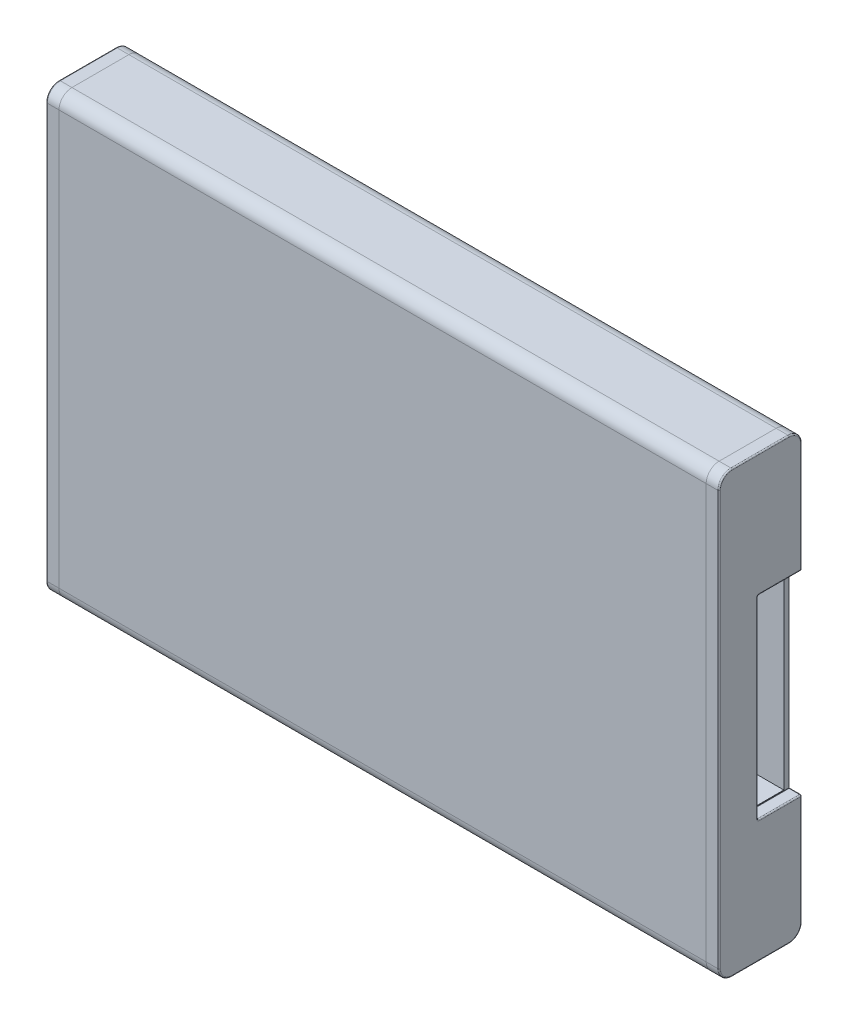
from build123d import *

# Parameters (mm, degrees)
SKETCH1_W           = 255
SKETCH1_H           = 170
BOSS_EXTRUDE1_DEPTH = 32
FILLET1_R           = 5
CUT_EXTRUDE1_DEPTH  = 5
BOSS_EXTRUDE2_DEPTH = 5
SKETCH4_W           = 17
SKETCH4_H           = 75
CUT_EXTRUDE2_DEPTH  = 5
SKETCH5_W           = 15
SKETCH5_H           = 75
CUT_EXTRUDE3_DEPTH  = 100
FILLET2_R           = 0.5
BOSS_EXTRUDE3_DEPTH = 5
FILLET3_R           = 0.5


with BuildPart() as part:
    # Sketch1 → Boss-Extrude1 (new body)
    with BuildSketch(Plane.XY):
        with Locations((127.5, 85)):
            Rectangle(SKETCH1_W, SKETCH1_H)
    extrude(amount=BOSS_EXTRUDE1_DEPTH)

    # Fillet1
    fillet1_edges = [part.edges().sort_by_distance(p)[0] for p in [
        (127.5, 170, 32),
        (127.5, 170, 0),
        (127.5, 0, 0),
        (127.5, 0, 32),
    ]]
    fillet(fillet1_edges, radius=FILLET1_R)

    # Sketch2 → Cut-Extrude1 (cut)
    with BuildSketch(Plane(origin=(255, 0, 0), x_dir=(0, 0, -1), z_dir=(1, 0, 0))):
        with BuildLine():
            Line((-32, 165), (-32, 5))
            ThreePointArc((-32, 5), (-30.535533906, 1.464466094), (-27, 0))
            Line((-27, 0), (-5, 0))
            ThreePointArc((-5, 0), (-1.464466094, 1.464466094), (0, 5))
            Line((0, 5), (0, 165))
            ThreePointArc((0, 165), (-1.464466094, 168.535533906), (-5, 170))
            Line((-5, 170), (-27, 170))
            ThreePointArc((-27, 170), (-30.535533906, 168.535533906), (-32, 165))
        make_face()
    extrude(amount=-CUT_EXTRUDE1_DEPTH, mode=Mode.SUBTRACT)

    # Sketch5 → Cut-Extrude3 (cut)
    with BuildSketch(Plane(origin=(250, 0, 0), x_dir=(0, 0, -1), z_dir=(1, 0, 0))):
        with Locations((-9.5, 85)):
            Rectangle(SKETCH5_W, SKETCH5_H)
    extrude(amount=-CUT_EXTRUDE3_DEPTH, mode=Mode.SUBTRACT)


with BuildPart() as body_2:
    # Sketch3 → Boss-Extrude2 (new body)
    with BuildSketch(Plane(origin=(250, 0, 0), x_dir=(0, 0, -1), z_dir=(1, 0, 0))):
        with BuildLine():
            Line((-32, 165), (-32, 5))
            ThreePointArc((-32, 5), (-30.535533906, 1.464466094), (-27, 0))
            Line((-27, 0), (-5, 0))
            ThreePointArc((-5, 0), (-1.464466094, 1.464466094), (0, 5))
            Line((0, 5), (0, 165))
            ThreePointArc((0, 165), (-1.464466094, 168.535533906), (-5, 170))
            Line((-5, 170), (-27, 170))
            ThreePointArc((-27, 170), (-30.535533906, 168.535533906), (-32, 165))
        make_face()
    extrude(amount=BOSS_EXTRUDE2_DEPTH)

    # Sketch4 → Cut-Extrude2 (cut)
    with BuildSketch(Plane(origin=(255, 0, 0), x_dir=(0, 0, -1), z_dir=(1, 0, 0))):
        with Locations((-8.5, 85)):
            Rectangle(SKETCH4_W, SKETCH4_H)
    extrude(amount=-CUT_EXTRUDE2_DEPTH, mode=Mode.SUBTRACT)

    # Fillet2
    fillet2_edges = [body_2.edges().sort_by_distance(p)[0] for p in [
        (255, 1.464466094, 30.535533906),
        (255, 0, 16),
        (255, 1.464466094, 1.464466094),
        (255, 26.25, 0),
        (255, 143.75, 0),
        (255, 168.535533906, 1.464466094),
        (252.5, 122.5, 0),
        (250, 47.5, 8.5),
        (252.5, 47.5, 0),
        (250, 85, 17),
        (252.5, 47.5, 17),
        (250, 122.5, 8.5),
        (252.5, 122.5, 17),
        (255, 122.5, 8.5),
        (255, 170, 16),
        (255, 85, 17),
        (255, 47.5, 8.5),
        (255, 168.535533906, 30.535533906),
        (255, 85, 32),
    ]]
    fillet(fillet2_edges, radius=FILLET2_R)


with BuildPart() as body_3:
    # Sketch6 → Boss-Extrude3 (new body)
    with BuildSketch(Plane.ZY):
        with BuildLine():
            Line((5, 0), (27, 0))
            ThreePointArc((27, 0), (30.535533906, 1.464466094), (32, 5))
            Line((32, 5), (32, 165))
            ThreePointArc((32, 165), (30.535533906, 168.535533906), (27, 170))
            Line((27, 170), (5, 170))
            ThreePointArc((5, 170), (1.464466094, 168.535533906), (0, 165))
            Line((0, 165), (0, 5))
            ThreePointArc((0, 5), (1.464466094, 1.464466094), (5, 0))
        make_face()
    extrude(amount=BOSS_EXTRUDE3_DEPTH)

    # Fillet3
    fillet3_edges = [body_3.edges().sort_by_distance(p)[0] for p in [
        (-5, 1.464466094, 30.535533906),
        (-5, 85, 32),
        (-5, 168.535533906, 30.535533906),
        (-5, 170, 16),
        (-5, 168.535533906, 1.464466094),
        (-5, 85, 0),
        (-5, 1.464466094, 1.464466094),
        (-5, 0, 16),
    ]]
    fillet(fillet3_edges, radius=FILLET3_R)


solid = Compound([part.part, body_2.part, body_3.part])
